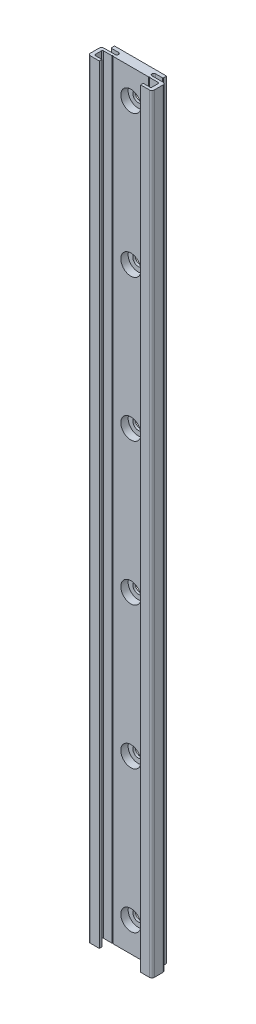
from build123d import *

# Parameters (mm, degrees)
BOSS_EXTRUDE1_DEPTH                              = 325
CBORE_FOR_M4_HEX_HEAD_MACHINE_SCREW1_D           = 4.5
CBORE_FOR_M4_HEX_HEAD_MACHINE_SCREW1_CBORE_D     = 8.5
CBORE_FOR_M4_HEX_HEAD_MACHINE_SCREW1_CBORE_DEPTH = 3.1
LPATTERN1_COUNT                                  = 6
LPATTERN1_PITCH                                  = 60


with BuildPart() as part:
    # Sketch1 → Boss-Extrude1 (new body)
    with BuildSketch(Plane.XZ.offset(-30)):
        with BuildLine():
            Line((-7.8, 1.5), (-10.8, 1.5))
            ThreePointArc((-10.8, 1.5), (-10.941421356, 1.441421356), (-11, 1.3))
            Line((-11, 1.3), (-11, 0))
            Line((-11, 0), (11, 0))
            Line((11, 0), (11, 1.3))
            ThreePointArc((11, 1.3), (10.941421356, 1.441421356), (10.8, 1.5))
            Line((10.8, 1.5), (7.8, 1.5))
            ThreePointArc((7.8, 1.5), (7.05, 2.249999999), (7.8, 2.999999999))
            Line((7.8, 2.999999999), (12.5, 2.999999999))
            ThreePointArc((12.5, 2.999999999), (13.207106782, 3.292893218), (13.5, 4))
            Line((13.5, 4), (13.5, 7.7))
            ThreePointArc((13.5, 7.7), (13.207106782, 8.407106781), (12.5, 8.7))
            Line((12.5, 8.7), (8.750000002, 8.7))
            Line((8.750000002, 8.7), (8.750000002, 7.599999996))
            Line((8.750000002, 7.599999996), (11.500000003, 7.599999996))
            ThreePointArc((11.500000003, 7.599999996), (11.853553391, 7.453553388), (11.999999999, 7.1))
            Line((11.999999999, 7.1), (11.999999999, 4.6))
            ThreePointArc((11.999999999, 4.6), (11.853553391, 4.246446612), (11.500000003, 4.100000003))
            Line((11.500000003, 4.100000003), (7.950000003, 4.100000003))
            ThreePointArc((7.950000003, 4.100000003), (7.750000003, 3.900000003), (7.550000003, 4.100000003))
            Line((7.550000003, 4.100000003), (-7.549999997, 4.100000003))
            ThreePointArc((-7.549999997, 4.100000003), (-7.749999997, 3.900000003), (-7.949999997, 4.100000003))
            Line((-7.949999997, 4.100000003), (-11.499999997, 4.100000003))
            ThreePointArc((-11.499999997, 4.100000003), (-11.853553386, 4.246446612), (-11.999999994, 4.6))
            Line((-11.999999994, 4.6), (-11.999999994, 7.1))
            ThreePointArc((-11.999999994, 7.1), (-11.853553386, 7.453553388), (-11.499999998, 7.599999996))
            Line((-11.499999998, 7.599999996), (-8.749999996, 7.599999996))
            Line((-8.749999996, 7.599999996), (-8.749999996, 8.7))
            Line((-8.749999996, 8.7), (-12.5, 8.7))
            ThreePointArc((-12.5, 8.7), (-13.207106782, 8.407106781), (-13.5, 7.7))
            Line((-13.5, 7.7), (-13.5, 4))
            ThreePointArc((-13.5, 4), (-13.207106782, 3.292893218), (-12.5, 2.999999999))
            Line((-12.5, 2.999999999), (-7.8, 2.999999999))
            ThreePointArc((-7.8, 2.999999999), (-7.05, 2.249999999), (-7.8, 1.5))
        make_face()
    extrude(amount=-BOSS_EXTRUDE1_DEPTH)

    # CBORE for M4 Hex Head Machine Screw1 (through all)
    with Locations(Plane.XY.offset(4.100000003)):
        with Locations((0, 42.5)):
            cbore_for_m4_hex_head_machine_screw1 = CounterBoreHole(CBORE_FOR_M4_HEX_HEAD_MACHINE_SCREW1_D / 2, CBORE_FOR_M4_HEX_HEAD_MACHINE_SCREW1_CBORE_D / 2, CBORE_FOR_M4_HEX_HEAD_MACHINE_SCREW1_CBORE_DEPTH)

    # LPattern1: CBORE for M4 Hex Head Machine Screw1 ×6
    with Locations(*[(0, i * LPATTERN1_PITCH, 0) for i in range(1, LPATTERN1_COUNT)]):
        add(cbore_for_m4_hex_head_machine_screw1, mode=Mode.SUBTRACT)


solid = part.part
